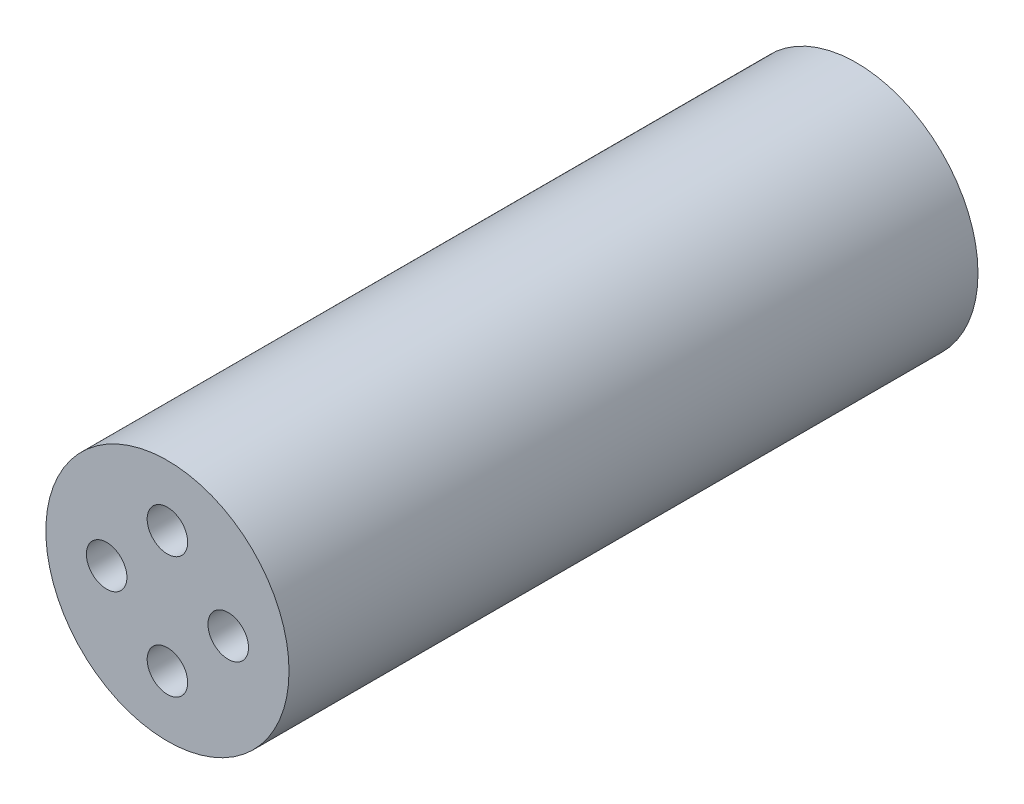
from build123d import *

# Parameters (mm, degrees)
SKETCH1_R           = 15
BOSS_EXTRUDE1_DEPTH = 85
SKETCH2_R           = 2.5
CUT_EXTRUDE1_DEPTH  = 20


with BuildPart() as part:
    # Sketch1 → Boss-Extrude1 (new body)
    with BuildSketch(Plane.XY):
        Circle(SKETCH1_R)
    extrude(amount=BOSS_EXTRUDE1_DEPTH)

    # Sketch2 → Cut-Extrude1 (cut)
    with BuildSketch(Plane.XY.offset(85)):
        with Locations((0, 7.5)):
            Circle(SKETCH2_R)
        with Locations((7.5, 0)):
            Circle(SKETCH2_R)
        with Locations((0, -7.5)):
            Circle(SKETCH2_R)
        with Locations((-7.5, 0)):
            Circle(SKETCH2_R)
    extrude(amount=-CUT_EXTRUDE1_DEPTH, mode=Mode.SUBTRACT)


solid = part.part
